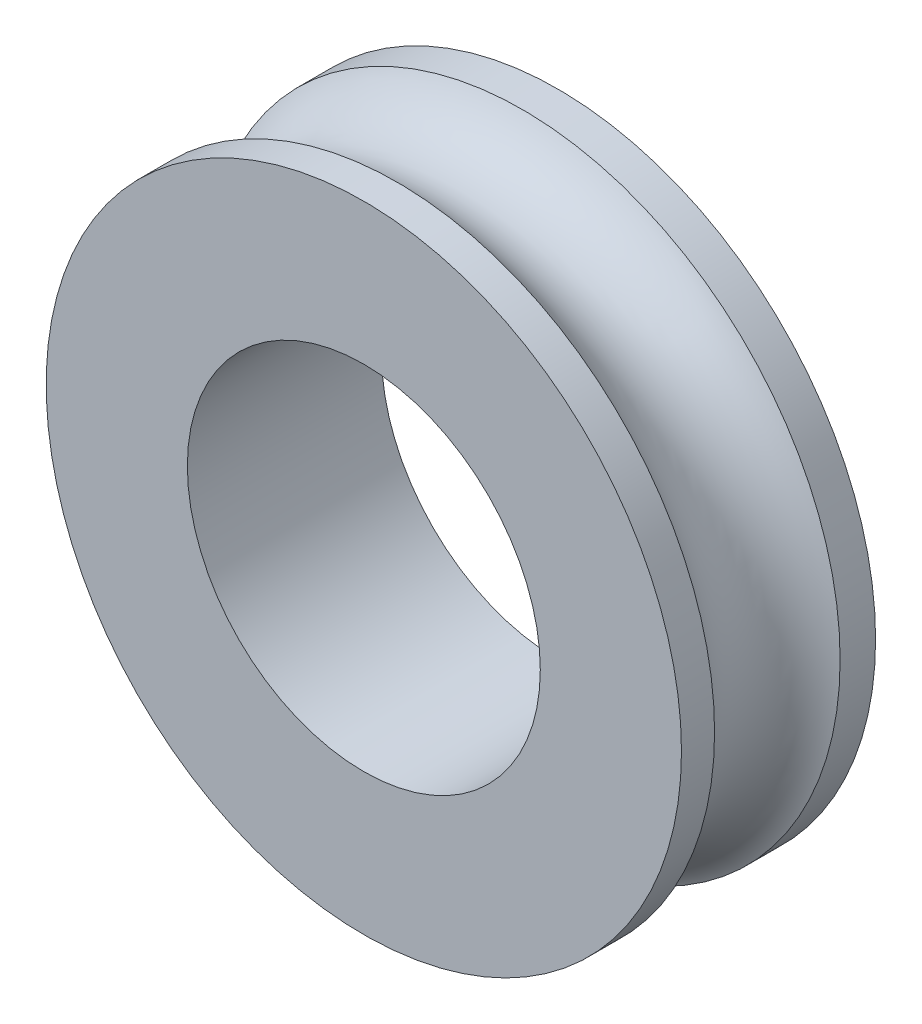
from build123d import *

# Parameters (mm, degrees)
SKETCH_1_R      = 9
SKETCH_1_R_2    = 5
EXTRUDE_1_DEPTH = 5.5
SKETCH_2_R      = 1.998258956


with BuildPart() as part:
    # 草图1 → 凸台-拉伸1 (new body)
    with BuildSketch(Plane.XY):
        Circle(SKETCH_1_R)
        Circle(SKETCH_1_R_2, mode=Mode.SUBTRACT)
    extrude(amount=EXTRUDE_1_DEPTH)

    # 切除-扫描1: sweep along a path in 草图3
    with BuildLine(Plane(origin=(0, 0, 0), x_dir=(-1, 0, 0), z_dir=(0, 0, -1))) as sweep_1_path:
        CenterArc((0, 0), 9.906713407, 0, 360)
    # 草图2 → 切除-扫描1 (sweep, cut)
    with BuildSketch(Plane(origin=(0, 0, 0), x_dir=(1, 0, 0), z_dir=(0, 1, 0))):
        with Locations((9.910827978, -2.783527835)):
            Circle(SKETCH_2_R)
    sweep(path=sweep_1_path.line, mode=Mode.SUBTRACT)


solid = part.part
